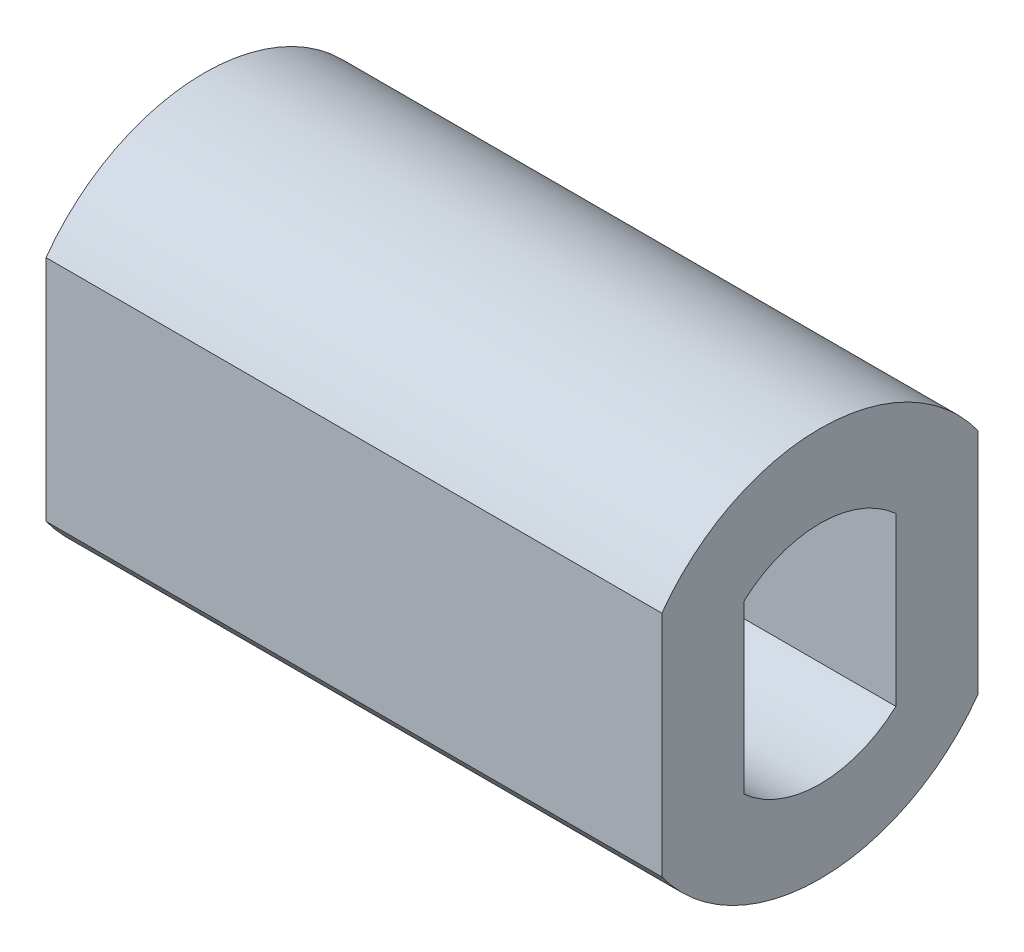
from build123d import *

# Parameters (mm, degrees)
SKETCH1_R           = 2.75
BOSS_EXTRUDE1_DEPTH = 11
CUT_EXTRUDE1_DEPTH  = 23.341105613
BOSS_EXTRUDE2_START = 9
BOSS_EXTRUDE2_DEPTH = 10
CUT_EXTRUDE2_START  = -13
CUT_EXTRUDE2_DEPTH  = 21
BOSS_EXTRUDE3_DEPTH = 5


with BuildPart() as part:
    # Sketch1 → Boss-Extrude1 (new, symmetric)
    with BuildSketch(Plane(origin=(0, 0, 0), x_dir=(0, 0, -1), z_dir=(1, 0, 0))):
        Circle(SKETCH1_R)
    extrude(amount=BOSS_EXTRUDE1_DEPTH, both=True)

    # Sketch2 → Cut-Extrude1 (cut, through all)
    with BuildSketch(Plane(origin=(11, 0, 0), x_dir=(0, 0, -1), z_dir=(1, 0, 0))):
        with BuildLine():
            Line((-1.85, 2.034698995), (-1.85, -2.034698995))
            ThreePointArc((-1.85, -2.034698995), (-2.75, 0), (-1.85, 2.034698995))
        make_face()
        with BuildLine():
            Line((1.85, 2.034698995), (1.85, -2.034698995))
            ThreePointArc((1.85, -2.034698995), (2.75, 0), (1.85, 2.034698995))
        make_face()
    extrude(amount=-CUT_EXTRUDE1_DEPTH, mode=Mode.SUBTRACT)

    # Sketch3 → Boss-Extrude2 (add)
    with BuildSketch(Plane(origin=(11, 0, 0), x_dir=(0, 0, -1), z_dir=(1, 0, 0)).offset(BOSS_EXTRUDE2_START)):
        with BuildLine():
            Line((-3.85, 2.782085549), (-3.85, -2.782085549))
            ThreePointArc((-3.85, -2.782085549), (0, -4.75), (3.85, -2.782085549))
            Line((3.85, -2.782085549), (3.85, 2.782085549))
            ThreePointArc((3.85, 2.782085549), (0, 4.75), (-3.85, 2.782085549))
        make_face()
        with BuildLine():
            Line((-1.85, 2.034698995), (-1.85, -2.034698995))
            ThreePointArc((-1.85, -2.034698995), (0, -2.75), (1.85, -2.034698995))
            Line((1.85, -2.034698995), (1.85, 2.034698995))
            ThreePointArc((1.85, 2.034698995), (0, 2.75), (-1.85, 2.034698995))
        make_face(mode=Mode.SUBTRACT)
    extrude(amount=-BOSS_EXTRUDE2_DEPTH)

    # Sketch5 → Cut-Extrude2 (cut)
    with BuildSketch(Plane.ZY.offset(3).offset(CUT_EXTRUDE2_START)):
        with BuildLine():
            Line((1.85, -2.034698995), (1.85, 2.034698995))
            ThreePointArc((1.85, 2.034698995), (0, 2.75), (-1.85, 2.034698995))
            Line((-1.85, 2.034698995), (-1.85, -2.034698995))
            ThreePointArc((-1.85, -2.034698995), (0, -2.75), (1.85, -2.034698995))
        make_face()
    extrude(amount=CUT_EXTRUDE2_DEPTH, mode=Mode.SUBTRACT)

    # Sketch6 → Boss-Extrude3 (add)
    with BuildSketch(Plane.ZY.offset(-10)):
        with BuildLine():
            ThreePointArc((3.85, 2.782085549), (0, 4.75), (-3.85, 2.782085549))
            Line((-3.85, 2.782085549), (-3.85, -2.782085549))
            ThreePointArc((-3.85, -2.782085549), (0, -4.75), (3.85, -2.782085549))
            Line((3.85, -2.782085549), (3.85, 2.782085549))
        make_face()
        with BuildLine():
            Line((-1.4, -2.877498914), (-1.4, 2.877498914))
            ThreePointArc((-1.4, 2.877498914), (3.2, 0), (-1.4, -2.877498914))
        make_face(mode=Mode.SUBTRACT)
    extrude(amount=BOSS_EXTRUDE3_DEPTH)


solid = part.part
